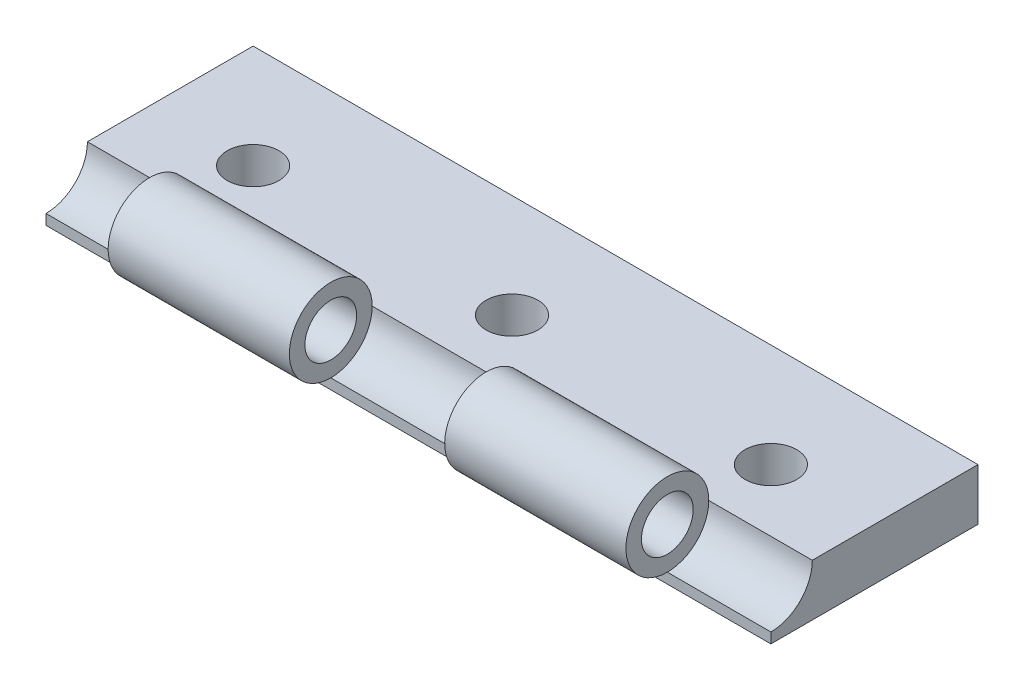
from build123d import *

# Parameters (mm, degrees)
SKETCH2_W           = 88.9
SKETCH2_H           = 25.4
SKETCH2_R           = 3.175
BOSS_EXTRUDE1_DEPTH = 6.35
SKETCH3_R           = 5.08
CUT_EXTRUDE1_DEPTH  = 93.675198948
SKETCH4_R           = 5.08
SKETCH4_R_2         = 3.175
BOSS_EXTRUDE2_DEPTH = 22.225


with BuildPart() as part:
    # Sketch2 → Boss-Extrude1 (new body)
    with BuildSketch(Plane(origin=(0, 0, 0), x_dir=(1, 0, 0), z_dir=(0, 1, 0))):
        with Locations((0, 12.7)):
            Rectangle(SKETCH2_W, SKETCH2_H)
        with Locations(Location((-31.75, 12.7, 0), (0, 0, 270))):
            Circle(SKETCH2_R, mode=Mode.SUBTRACT)
        with Locations(Location((0, 12.7, 0), (0, 0, 270))):
            Circle(SKETCH2_R, mode=Mode.SUBTRACT)
        with Locations(Location((31.75, 12.7, 0), (0, 0, 270))):
            Circle(SKETCH2_R, mode=Mode.SUBTRACT)
    extrude(amount=BOSS_EXTRUDE1_DEPTH)

    # Sketch3 → Cut-Extrude1 (cut, through all)
    with BuildSketch(Plane.ZY.offset(44.45)):
        with Locations((0, 6.35)):
            Circle(SKETCH3_R)
    extrude(amount=-CUT_EXTRUDE1_DEPTH, mode=Mode.SUBTRACT)

    # Sketch4 → Boss-Extrude2 (add)
    with BuildSketch(Plane(origin=(9.525, 0, 0), x_dir=(0, 0, -1), z_dir=(1, 0, 0))):
        with Locations((0, 6.35)):
            Circle(SKETCH4_R)
        with Locations((0, 6.35)):
            Circle(SKETCH4_R_2, mode=Mode.SUBTRACT)
    boss_extrude2 = extrude(amount=BOSS_EXTRUDE2_DEPTH)

    # Mirror1: Boss-Extrude2 across plane
    add(boss_extrude2.mirror(Plane(origin=(0, 0, 0), x_dir=(0, 0, 1), z_dir=(1, 0, 0))))


solid = part.part
